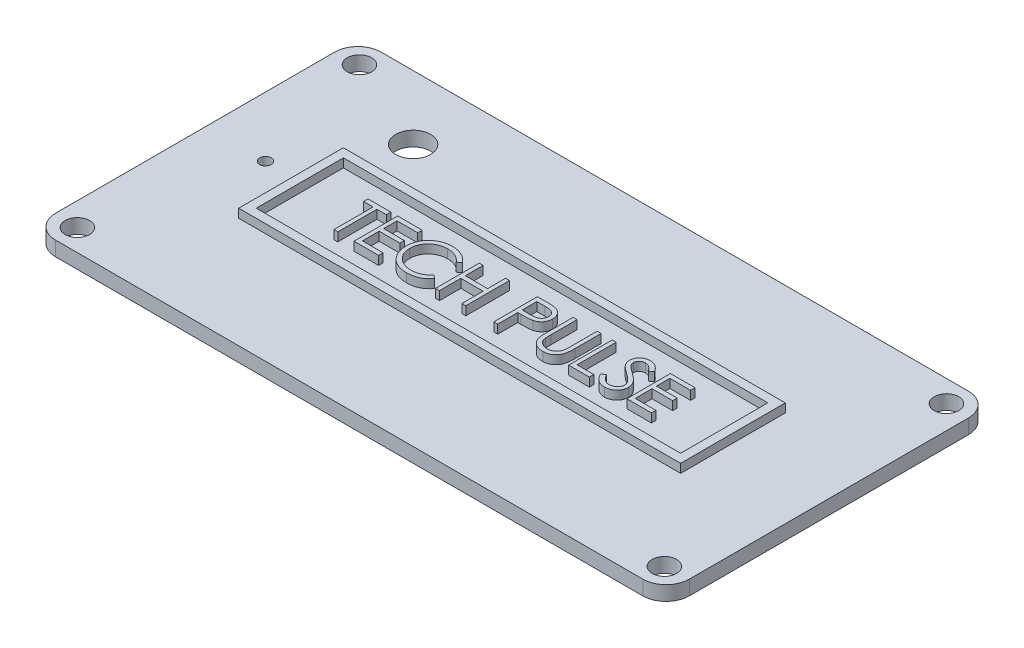
from build123d import *

# Parameters (mm, degrees)
SKETCH1_W           = 109
SKETCH1_H           = 56
TOP_PLATE_DEPTH     = 2.5
FILLET2_R           = 4
SKETCH7_R           = 3
CUT_EXTRUDE3_DEPTH  = 5
SKETCH11_R          = 2.1
CUT_EXTRUDE5_DEPTH  = 4
SKETCH12_W          = 76
SKETCH12_H          = 18
BOSS_EXTRUDE1_DEPTH = 1.5
SKETCH13_W          = 73
SKETCH13_H          = 15
CUT_EXTRUDE6_DEPTH  = 1.5
BOSS_EXTRUDE2_DEPTH = 1.5
SKETCH15_R          = 1
CUT_EXTRUDE7_DEPTH  = 3


with BuildPart() as part:
    # Sketch1 → Top_Plate (new body)
    with BuildSketch(Plane(origin=(0, 0, 0), x_dir=(1, 0, 0), z_dir=(0, 1, 0))):
        Rectangle(SKETCH1_W, SKETCH1_H)
    extrude(amount=TOP_PLATE_DEPTH)

    # Fillet2
    fillet2_edges = [part.edges().sort_by_distance(p)[0] for p in [
        (-54.5, 1.25, -28),
        (54.5, 1.25, -28),
        (54.5, 1.25, 28),
        (-54.5, 1.25, 28),
    ]]
    fillet(fillet2_edges, radius=FILLET2_R)

    # Sketch7 → Cut-Extrude3 (cut)
    with BuildSketch(Plane(origin=(0, 2.5, 0), x_dir=(1, 0, 0), z_dir=(0, 1, 0))):
        with Locations(Location((-34, 17, 0), (0, 0, 270))):
            Circle(SKETCH7_R)
    extrude(amount=-CUT_EXTRUDE3_DEPTH, mode=Mode.SUBTRACT)

    # Sketch11 → Cut-Extrude5 (cut)
    with BuildSketch(Plane(origin=(0, 2.5, 0), x_dir=(1, 0, 0), z_dir=(0, 1, 0))):
        with Locations(Location((-50.477110926, 24.241441247, 0), (0, 0, 270))):
            Circle(SKETCH11_R)
        with Locations(Location((-50.492546185, -24.258556297, 0), (0, 0, 270))):
            Circle(SKETCH11_R)
        with Locations(Location((50.461675666, -24.258556297, 0), (0, 0, 270))):
            Circle(SKETCH11_R)
        with Locations(Location((50.477110926, 24.241441247, 0), (0, 0, 270))):
            Circle(SKETCH11_R)
    extrude(amount=-CUT_EXTRUDE5_DEPTH, mode=Mode.SUBTRACT)

    # Sketch12 → Boss-Extrude1 (add)
    with BuildSketch(Plane(origin=(0, 2.5, 0), x_dir=(1, 0, 0), z_dir=(0, 1, 0))):
        Rectangle(SKETCH12_W, SKETCH12_H)
    extrude(amount=BOSS_EXTRUDE1_DEPTH)

    # Sketch13 → Cut-Extrude6 (cut)
    with BuildSketch(Plane(origin=(0, 4, 0), x_dir=(1, 0, 0), z_dir=(0, 1, 0))):
        Rectangle(SKETCH13_W, SKETCH13_H)
    extrude(amount=-CUT_EXTRUDE6_DEPTH, mode=Mode.SUBTRACT)

    # Sketch14 → Boss-Extrude2 (add)
    # profile 1 of 9: a face of its own
    with BuildSketch(Plane(origin=(0, 2.5, 0), x_dir=(1, 0, 0), z_dir=(0, 1, 0))):
        Polygon((-28.269230769, 2.730769231), (-28.269230769, 3.5), (-24.326923077, 3.5), (-24.326923077, 2.730769231), (-25.961538462, 2.730769231), (-25.961538462, -4), (-26.634615385, -4), (-26.634615385, 2.730769231), align=None)
    # profile 2 of 9: a face of its own
    with BuildSketch(Plane(origin=(0, 2.5, 0), x_dir=(1, 0, 0), z_dir=(0, 1, 0))):
        Polygon((-23.173076923, 3.5), (-18.942307692, 3.5), (-18.942307692, 2.730769231), (-22.5, 2.730769231), (-22.5, 0.423076923), (-18.942307692, 0.423076923), (-18.942307692, -0.346153846), (-22.5, -0.346153846), (-22.5, -3.230769231), (-18.942307692, -3.230769231), (-18.942307692, -4), (-23.173076923, -4), align=None)
    # profile 3 of 9: a face of its own
    with BuildSketch(Plane(origin=(0, 2.5, 0), x_dir=(1, 0, 0), z_dir=(0, 1, 0))):
        with BuildLine():
            Line((-10.673076923, 2.123798077), (-11.262019231, 1.673076923))
            add(Edge.make_bspline(
                [(-11.262019231, 1.673076923), (-11.304031849, 1.723146858), (-11.387490663, 1.822611678), (-11.521760383, 1.96228213), (-11.661692475, 2.093136262), (-11.807233449, 2.215797433), (-11.961002991, 2.325976216), (-12.119276131, 2.429414294), (-12.284700513, 2.522130875), (-12.51345423, 2.63455156), (-12.81269962, 2.751864749), (-13.189402846, 2.850228816), (-13.582640914, 2.912845621), (-13.850921485, 2.919627424), (-13.987379808, 2.923076923)],
                knots=[0, 0, 0, 0, 0.757959112, 1.505699292, 2.245454638, 2.979532153, 3.711538275, 4.438200793, 5.171680507, 5.909471876, 7.393775596, 8.890124382, 10.418191784, 12, 12, 12, 12], degree=3))
            add(Edge.make_bspline(
                [(-13.987379808, 2.923076923), (-14.062558306, 2.922211289), (-14.212217576, 2.920488055), (-14.434321448, 2.897754215), (-14.652277986, 2.865801622), (-14.865945414, 2.818390216), (-15.075051753, 2.758448889), (-15.280964043, 2.686823002), (-15.480701043, 2.598205488), (-15.677025839, 2.500259217), (-15.865124148, 2.389628978), (-16.043099251, 2.26895751), (-16.210302039, 2.13959516), (-16.36686478, 2.001057075), (-16.512947526, 1.85396716), (-16.647491763, 1.696757856), (-16.770031928, 1.52993177), (-16.882996982, 1.355688754), (-16.984167125, 1.174536343), (-17.068874009, 0.98580405), (-17.143884985, 0.792723829), (-17.203240505, 0.593114198), (-17.250221613, 0.3883797), (-17.282638034, 0.177970869), (-17.30511333, -0.03767273), (-17.306827994, -0.183835543), (-17.307692308, -0.257512019)],
                knots=[0, 0, 0, 0, 1.054917814, 2.100044995, 3.131103042, 4.146048494, 5.169673617, 6.183595914, 7.203665975, 8.234915748, 9.262203917, 10.264457458, 11.251630812, 12.227803204, 13.197192746, 14.159520551, 15.12972552, 16.100847026, 17.073214652, 18.039054194, 19.002613845, 19.979014051, 20.95965708, 21.949030935, 22.966165397, 24, 24, 24, 24], degree=3))
            add(Edge.make_bspline(
                [(-17.307692308, -0.257512019), (-17.30498841, -0.368364848), (-17.299679665, -0.586009672), (-17.252433235, -0.904803838), (-17.180636611, -1.210205282), (-17.073031803, -1.500304944), (-16.940348123, -1.778679997), (-16.77268967, -2.040620397), (-16.578511375, -2.290084464), (-16.355066191, -2.521176495), (-16.109910871, -2.732277334), (-15.846879632, -2.918171438), (-15.566627587, -3.0731319), (-15.272249093, -3.202080357), (-14.961478849, -3.301201916), (-14.634875701, -3.370982181), (-14.293149997, -3.416501139), (-14.05964414, -3.420859042), (-13.940805288, -3.423076923)],
                knots=[0, 0, 0, 0, 1.029171465, 2.020641659, 2.987623507, 3.938342917, 4.889210282, 5.84687017, 6.821220943, 7.821438502, 8.827599549, 9.822697543, 10.807740252, 11.797342354, 12.80366471, 13.83203677, 14.896651826, 16, 16, 16, 16], degree=3))
            add(Edge.make_bspline(
                [(-13.940805288, -3.423076923), (-13.809870955, -3.419458109), (-13.552160864, -3.412335418), (-13.174229379, -3.35199417), (-12.812438453, -3.254155775), (-12.466768625, -3.117231655), (-12.138194383, -2.93923461), (-11.826201539, -2.723453444), (-11.530526745, -2.467835588), (-11.352731141, -2.272657456), (-11.262019231, -2.173076923)],
                knots=[0, 0, 0, 0, 1.028121516, 2.023589091, 2.998037872, 3.967518031, 4.937445131, 5.927275754, 6.942489185, 8, 8, 8, 8], degree=3))
            Line((-11.262019231, -2.173076923), (-10.673076923, -2.619290865))
            add(Edge.make_bspline(
                [(-10.673076923, -2.619290865), (-10.720472873, -2.680444691), (-10.815037748, -2.802459419), (-10.968162071, -2.974470225), (-11.129470565, -3.136264587), (-11.300161372, -3.286538061), (-11.478270925, -3.42829763), (-11.666997309, -3.55751584), (-11.863859522, -3.675996306), (-12.068190548, -3.784482573), (-12.27977329, -3.880733817), (-12.498354222, -3.963134748), (-12.722991169, -4.034116654), (-12.953694401, -4.092513661), (-13.190942452, -4.138094555), (-13.433879182, -4.168565287), (-13.683028915, -4.189440818), (-13.851117674, -4.191343495), (-13.936298077, -4.192307692)],
                knots=[0, 0, 0, 0, 0.986787822, 1.968848986, 2.935600012, 3.899624008, 4.868462664, 5.837806735, 6.815139263, 7.798259679, 8.787526145, 9.778297419, 10.776456485, 11.791383307, 12.812564526, 13.85620153, 14.913611965, 16, 16, 16, 16], degree=3))
            add(Edge.make_bspline(
                [(-13.936298077, -4.192307692), (-14.016963078, -4.19174628), (-14.176468128, -4.190636156), (-14.411965453, -4.17265294), (-14.64122884, -4.148117789), (-14.863603039, -4.111174651), (-15.080301557, -4.067579637), (-15.289359952, -4.00914123), (-15.492835403, -3.94367873), (-15.689910418, -3.866739473), (-15.880752632, -3.779919082), (-16.064746514, -3.681794313), (-16.24180744, -3.573190317), (-16.413676199, -3.456501009), (-16.577813879, -3.327978219), (-16.735642861, -3.189406859), (-16.888048168, -3.041253979), (-16.982339636, -2.934422151), (-17.029747596, -2.880709135)],
                knots=[0, 0, 0, 0, 1.114604814, 2.203992996, 3.262667896, 4.300477797, 5.318619304, 6.316056647, 7.298880507, 8.271930387, 9.238335007, 10.195173496, 11.151986948, 12.108099108, 13.064862484, 14.031167946, 15.010108607, 16, 16, 16, 16], degree=3))
            add(Edge.make_bspline(
                [(-17.029747596, -2.880709135), (-17.105681118, -2.787406587), (-17.256631425, -2.601927922), (-17.44975789, -2.301315105), (-17.61507408, -1.987454657), (-17.748736767, -1.658697667), (-17.853228338, -1.315781837), (-17.925616614, -0.958534306), (-17.972655766, -0.587288716), (-17.978034956, -0.334781312), (-17.980769231, -0.206430288)],
                knots=[0, 0, 0, 0, 0.994628077, 1.977248131, 2.950237994, 3.925870899, 4.908910175, 5.911660606, 6.938484602, 8, 8, 8, 8], degree=3))
            add(Edge.make_bspline(
                [(-17.980769231, -0.206430288), (-17.977436673, -0.071525745), (-17.970880074, 0.193890522), (-17.915174798, 0.583406136), (-17.825563092, 0.956587705), (-17.698284045, 1.312738586), (-17.536915435, 1.653732044), (-17.337572691, 1.976963197), (-17.102571672, 2.284499196), (-16.833755456, 2.571673663), (-16.538968308, 2.83425799), (-16.223285136, 3.065271284), (-15.887323821, 3.257523104), (-15.534785567, 3.418229167), (-15.163030535, 3.541753016), (-14.772851887, 3.62822413), (-14.364982784, 3.682046522), (-14.086706158, 3.688850539), (-13.9453125, 3.692307692)],
                knots=[0, 0, 0, 0, 1.032925535, 2.032216505, 3.007276963, 3.968222605, 4.92396291, 5.891752235, 6.871517503, 7.883894988, 8.900124299, 9.891468569, 10.874487609, 11.85992873, 12.854644235, 13.869047385, 14.917252991, 16, 16, 16, 16], degree=3))
            add(Edge.make_bspline(
                [(-13.9453125, 3.692307692), (-13.859138632, 3.691274539), (-13.688566137, 3.689229516), (-13.436239025, 3.669287783), (-13.190576896, 3.636044341), (-12.951410506, 3.59079562), (-12.717576328, 3.534637074), (-12.490861526, 3.461479292), (-12.269935769, 3.377829582), (-12.056192394, 3.281490012), (-11.85065693, 3.173346995), (-11.65339339, 3.05459923), (-11.465968693, 2.925393933), (-11.287064017, 2.786829985), (-11.119672137, 2.63597593), (-10.959040397, 2.476981081), (-10.810623801, 2.305265744), (-10.719009811, 2.184398028), (-10.673076923, 2.123798077)],
                knots=[0, 0, 0, 0, 1.096760587, 2.17092713, 3.219439832, 4.250915756, 5.268269357, 6.278326846, 7.281116186, 8.274029601, 9.260640565, 10.235837813, 11.203064059, 12.156899882, 13.114053108, 14.069676657, 15.032185724, 16, 16, 16, 16], degree=3))
        make_face()
    # profile 4 of 9: a face of its own
    with BuildSketch(Plane(origin=(0, 2.5, 0), x_dir=(1, 0, 0), z_dir=(0, 1, 0))):
        Polygon((-9.134615385, 3.5), (-8.461538462, 3.5), (-8.461538462, 0.423076923), (-4.615384615, 0.423076923), (-4.615384615, 3.5), (-3.942307692, 3.5), (-3.942307692, -4), (-4.615384615, -4), (-4.615384615, -0.346153846), (-8.461538462, -0.346153846), (-8.461538462, -4), (-9.134615385, -4), align=None)
    # profile 5 of 9: a face of its own
    with BuildSketch(Plane(origin=(0, 2.5, 0), x_dir=(1, 0, 0), z_dir=(0, 1, 0))):
        with BuildLine():
            Line((0.865384615, 3.5), (2.336237981, 3.5))
            add(Edge.make_bspline(
                [(2.336237981, 3.5), (2.437404208, 3.499888794), (2.631243193, 3.499675718), (2.909204026, 3.493215548), (3.161653451, 3.484586922), (3.388047125, 3.472625722), (3.589081621, 3.458490172), (3.763847263, 3.438664373), (3.91371774, 3.41796374), (4.003517275, 3.396917869), (4.044471154, 3.387319712)],
                knots=[0, 0, 0, 0, 1.415646017, 2.712440637, 3.8905458, 4.950247383, 5.884950622, 6.709939814, 7.411656543, 8, 8, 8, 8], degree=3))
            add(Edge.make_bspline(
                [(4.044471154, 3.387319712), (4.096314441, 3.373129819), (4.198779392, 3.345084401), (4.346424484, 3.288912137), (4.48689701, 3.222307497), (4.620678921, 3.146399054), (4.746126242, 3.057929988), (4.865110615, 2.960486522), (4.976582002, 2.851818875), (5.079913556, 2.733145861), (5.174809551, 2.606459697), (5.256516014, 2.469869204), (5.3249315, 2.325673554), (5.383609939, 2.173973044), (5.425842341, 2.01349378), (5.457657127, 1.845350825), (5.477850614, 1.669562203), (5.479784675, 1.549433915), (5.480769231, 1.48828125)],
                knots=[0, 0, 0, 0, 0.999701418, 1.975846123, 2.934577507, 3.890451536, 4.834027766, 5.787354733, 6.749476667, 7.726910423, 8.712836071, 9.690891519, 10.682875813, 11.679750201, 12.712814741, 13.765529915, 14.8625177, 16, 16, 16, 16], degree=3))
            add(Edge.make_bspline(
                [(5.480769231, 1.48828125), (5.479866178, 1.426614585), (5.478099294, 1.305959591), (5.456892968, 1.129446474), (5.428328272, 0.960764209), (5.384406017, 0.800286815), (5.326879574, 0.648967307), (5.259396604, 0.504493239), (5.178003324, 0.369322513), (5.084478689, 0.242964404), (4.980439559, 0.125300306), (4.86632612, 0.017182889), (4.742599064, -0.080754979), (4.609651604, -0.168732858), (4.466187642, -0.2447106), (4.314383028, -0.312761967), (4.152918278, -0.36991424), (4.04118432, -0.399978658), (3.984375, -0.415264423)],
                knots=[0, 0, 0, 0, 1.121902311, 2.195077645, 3.232258892, 4.234102512, 5.217864754, 6.176164875, 7.132989551, 8.084763148, 9.034132444, 9.988522005, 10.94243251, 11.903244335, 12.886203696, 13.894208494, 14.929344452, 16, 16, 16, 16], degree=3))
            add(Edge.make_bspline(
                [(3.984375, -0.415264423), (3.937387856, -0.425256525), (3.834412797, -0.447154799), (3.66482125, -0.471601492), (3.467366851, -0.492467779), (3.242319108, -0.508113074), (2.989880027, -0.521506721), (2.709913047, -0.532152636), (2.401868595, -0.538002323), (2.187001644, -0.538304022), (2.074819712, -0.538461538)],
                knots=[0, 0, 0, 0, 0.601384939, 1.31797006, 2.144135048, 3.087295005, 4.142315834, 5.309527816, 6.595305764, 8, 8, 8, 8], degree=3))
            Line((2.074819712, -0.538461538), (1.538461538, -0.538461538))
            Line((1.538461538, -0.538461538), (1.538461538, -4))
            Line((1.538461538, -4), (0.865384615, -4))
            Line((0.865384615, -4), (0.865384615, 3.5))
        make_face()
        with BuildLine():
            Line((1.538461538, 2.730769231), (1.538461538, 0.230769231))
            Line((1.538461538, 0.230769231), (2.8515625, 0.214242788))
            add(Edge.make_bspline(
                [(2.8515625, 0.214242788), (2.915676627, 0.214209652), (3.039447627, 0.214145683), (3.218239534, 0.222685448), (3.384116578, 0.232543732), (3.536569239, 0.246977854), (3.675666242, 0.267380549), (3.801639518, 0.28797713), (3.913512267, 0.317774335), (4.044439128, 0.357895198), (4.190332015, 0.426322231), (4.349048191, 0.525643424), (4.48355659, 0.652244942), (4.59995294, 0.794590295), (4.692322679, 0.952945572), (4.759942662, 1.122379008), (4.799673714, 1.301152971), (4.805001272, 1.423484697), (4.807692308, 1.485276442)],
                knots=[0, 0, 0, 0, 1.160613943, 2.240541288, 3.23993089, 4.169200891, 5.011653406, 5.7853311, 6.478053781, 7.106038997, 8.262395093, 9.384106736, 10.481365981, 11.59014053, 12.70357646, 13.786202915, 14.881775077, 16, 16, 16, 16], degree=3))
            add(Edge.make_bspline(
                [(4.807692308, 1.485276442), (4.804986637, 1.545573257), (4.799608097, 1.665435861), (4.759631248, 1.841104634), (4.692454147, 2.008752572), (4.599332873, 2.165123469), (4.486316166, 2.306956621), (4.35496043, 2.43016475), (4.20557487, 2.529211256), (4.066614375, 2.593139717), (3.943183262, 2.63217245), (3.83597192, 2.659482822), (3.714920474, 2.681287693), (3.579989518, 2.69894377), (3.432224874, 2.71405833), (3.270357057, 2.724313995), (3.09499925, 2.730317116), (2.973262312, 2.730614877), (2.91015625, 2.730769231)],
                knots=[0, 0, 0, 0, 1.120700087, 2.227813068, 3.331159281, 4.466773991, 5.599788987, 6.693661531, 7.80175334, 8.91857717, 9.525282508, 10.207424825, 10.974604443, 11.810962634, 12.737642355, 13.736264703, 14.826523623, 16, 16, 16, 16], degree=3))
            Line((2.91015625, 2.730769231), (1.538461538, 2.730769231))
        make_face(mode=Mode.SUBTRACT)
    # profile 6 of 9: a face of its own
    with BuildSketch(Plane(origin=(0, 2.5, 0), x_dir=(1, 0, 0), z_dir=(0, 1, 0))):
        with BuildLine():
            Line((7.019230769, 3.5), (7.692307692, 3.5))
            Line((7.692307692, 3.5), (7.692307692, -0.993689904))
            add(Edge.make_bspline(
                [(7.692307692, -0.993689904), (7.692207527, -1.05729148), (7.692017445, -1.177986432), (7.693287118, -1.349775648), (7.696842907, -1.502502346), (7.699084678, -1.636755234), (7.704071821, -1.751918264), (7.708139064, -1.848615358), (7.713368829, -1.926388649), (7.71965408, -1.971776348), (7.722355769, -1.991286058)],
                knots=[0, 0, 0, 0, 1.528628734, 2.90083645, 4.128790002, 5.200304208, 6.127813768, 6.898992206, 7.526736466, 8, 8, 8, 8], degree=3))
            add(Edge.make_bspline(
                [(7.722355769, -1.991286058), (7.733450324, -2.061671979), (7.755014295, -2.198477827), (7.809970818, -2.393281288), (7.886722606, -2.568848699), (7.977671983, -2.730658609), (8.097527579, -2.874207237), (8.241106583, -3.006446493), (8.415058945, -3.12210036), (8.608474528, -3.2278521), (8.816942894, -3.312848705), (9.029967036, -3.3771202), (9.244344849, -3.416289271), (9.387865203, -3.420824712), (9.459134615, -3.423076923)],
                knots=[0, 0, 0, 0, 1.035780045, 2.013197591, 2.933192213, 3.817615948, 4.702609284, 5.640816605, 6.646850145, 7.73207398, 8.84249596, 9.914020372, 10.964143139, 12, 12, 12, 12], degree=3))
            add(Edge.make_bspline(
                [(9.459134615, -3.423076923), (9.520321202, -3.420775815), (9.642340977, -3.41618689), (9.823640472, -3.387769538), (10.000212133, -3.33655404), (10.172927876, -3.270468844), (10.334822842, -3.183152577), (10.485987361, -3.082286493), (10.620910077, -2.963977472), (10.744034358, -2.833048163), (10.851252078, -2.68532002), (10.944190239, -2.524009724), (11.020317231, -2.346689695), (11.057910498, -2.222073076), (11.077223558, -2.158052885)],
                knots=[0, 0, 0, 0, 0.994687771, 1.983630487, 2.973142513, 3.978332533, 4.983357753, 5.956394766, 6.925816176, 7.893390482, 8.871859704, 9.88551698, 10.913711441, 12, 12, 12, 12], degree=3))
            add(Edge.make_bspline(
                [(11.077223558, -2.158052885), (11.083652398, -2.131591654), (11.097978444, -2.072625368), (11.111364969, -1.972936888), (11.125307523, -1.855316823), (11.134981602, -1.718920081), (11.144412788, -1.564203711), (11.150055087, -1.390361731), (11.152663015, -1.198025386), (11.153440187, -1.063802897), (11.153846154, -0.993689904)],
                knots=[0, 0, 0, 0, 0.558680831, 1.244966039, 2.062412453, 2.990489873, 4.051219941, 5.244515665, 6.560634259, 8, 8, 8, 8], degree=3))
            Line((11.153846154, -0.993689904), (11.153846154, 3.5))
            Line((11.153846154, 3.5), (11.826923077, 3.5))
            Line((11.826923077, 3.5), (11.826923077, -1.029747596))
            add(Edge.make_bspline(
                [(11.826923077, -1.029747596), (11.826378533, -1.11138698), (11.825315823, -1.2707112), (11.816100302, -1.504178398), (11.801406731, -1.725649072), (11.780646542, -1.935152993), (11.753138679, -2.131940477), (11.72254892, -2.317736409), (11.683592778, -2.491207108), (11.638092633, -2.653705146), (11.586077887, -2.808388389), (11.518703998, -2.955192563), (11.442794355, -3.098580562), (11.352762956, -3.236383653), (11.251595707, -3.369211981), (11.137056391, -3.496259999), (11.012933189, -3.619557955), (10.877162705, -3.735943097), (10.731983008, -3.842675976), (10.577825955, -3.936528342), (10.415875735, -4.015864666), (10.246553321, -4.081170218), (10.069786458, -4.13027293), (9.885570687, -4.16686255), (9.693486702, -4.187653187), (9.562848153, -4.190743038), (9.496694712, -4.192307692)],
                knots=[0, 0, 0, 0, 1.316592851, 2.569410997, 3.76748051, 4.895814652, 5.963796859, 6.97159953, 7.931736103, 8.829262218, 9.692595152, 10.560224239, 11.431080259, 12.30701507, 13.211635791, 14.121146779, 15.063487852, 16.031507147, 17.00238618, 17.966455255, 18.938106653, 19.907068911, 20.888905087, 21.893141452, 22.933117798, 24, 24, 24, 24], degree=3))
            add(Edge.make_bspline(
                [(9.496694712, -4.192307692), (9.424546635, -4.190626052), (9.282992365, -4.187326681), (9.074410793, -4.168420788), (8.874451801, -4.132809943), (8.681003493, -4.087467206), (8.49669957, -4.024930627), (8.319070761, -3.951863216), (8.151159301, -3.86212623), (7.990241169, -3.762283245), (7.840616691, -3.649944734), (7.703265113, -3.527501505), (7.577959676, -3.396914982), (7.46681247, -3.256771341), (7.367982003, -3.10816054), (7.282845831, -2.950662169), (7.209746022, -2.784337206), (7.172017664, -2.668723205), (7.152944712, -2.610276442)],
                knots=[0, 0, 0, 0, 1.13879206, 2.234305948, 3.301075583, 4.341971843, 5.366689343, 6.369221514, 7.369726634, 8.367512178, 9.355451585, 10.318319045, 11.268648973, 12.207971039, 13.137398894, 14.081662264, 15.030215811, 16, 16, 16, 16], degree=3))
            add(Edge.make_bspline(
                [(7.152944712, -2.610276442), (7.141850801, -2.570349497), (7.117787863, -2.483747064), (7.092019368, -2.340418874), (7.07035705, -2.175386907), (7.049987996, -1.988639868), (7.037968801, -1.780033011), (7.027431432, -1.549656763), (7.019156535, -1.297232559), (7.019205333, -1.121401454), (7.019230769, -1.029747596)],
                knots=[0, 0, 0, 0, 0.625038921, 1.35572334, 2.194682327, 3.136881307, 4.189498639, 5.346923369, 6.617055217, 8, 8, 8, 8], degree=3))
            Line((7.019230769, -1.029747596), (7.019230769, 3.5))
        make_face()
    # profile 7 of 9: a face of its own
    with BuildSketch(Plane(origin=(0, 2.5, 0), x_dir=(1, 0, 0), z_dir=(0, 1, 0))):
        Polygon((13.75, 3.5), (14.423076923, 3.5), (14.423076923, -3.230769231), (17.307692308, -3.230769231), (17.307692308, -4), (13.75, -4), align=None)
    # profile 8 of 9: a face of its own
    with BuildSketch(Plane(origin=(0, 2.5, 0), x_dir=(1, 0, 0), z_dir=(0, 1, 0))):
        with BuildLine():
            Line((17.788461538, -2.553185096), (18.422475962, -2.173076923))
            add(Edge.make_bspline(
                [(18.422475962, -2.173076923), (18.481443613, -2.271786319), (18.594423357, -2.460909713), (18.782890555, -2.716462657), (18.978175365, -2.933667279), (19.181723937, -3.111260009), (19.392293826, -3.251079052), (19.611259655, -3.350083835), (19.837883535, -3.411832353), (19.992113153, -3.419332539), (20.069110577, -3.423076923)],
                knots=[0, 0, 0, 0, 1.272034388, 2.437168799, 3.508375237, 4.49857839, 5.41946034, 6.295179144, 7.148887113, 8, 8, 8, 8], degree=3))
            add(Edge.make_bspline(
                [(20.069110577, -3.423076923), (20.134868135, -3.421245482), (20.265232649, -3.417614646), (20.457151741, -3.382727213), (20.643541317, -3.329129794), (20.820559827, -3.252370655), (20.985764715, -3.159502471), (21.130636205, -3.047332091), (21.255877876, -2.921747364), (21.358325979, -2.781641676), (21.436926054, -2.630962071), (21.497337629, -2.476299319), (21.530862787, -2.315223815), (21.535912973, -2.206772823), (21.538461538, -2.152043269)],
                knots=[0, 0, 0, 0, 1.095163259, 2.171163733, 3.241058638, 4.321873601, 5.38011039, 6.391990106, 7.366004449, 8.327778327, 9.272591725, 10.192022065, 11.087607919, 12, 12, 12, 12], degree=3))
            add(Edge.make_bspline(
                [(21.538461538, -2.152043269), (21.535302301, -2.089598591), (21.528880034, -1.962657686), (21.474598291, -1.775372715), (21.389207047, -1.590031494), (21.310429954, -1.475385925), (21.26953125, -1.415865385)],
                knots=[0, 0, 0, 0, 0.938893495, 1.908633276, 2.914225137, 4, 4, 4, 4], degree=3))
            add(Edge.make_bspline(
                [(21.26953125, -1.415865385), (21.235951362, -1.372907905), (21.165454589, -1.282724051), (21.044259919, -1.148484261), (20.902046817, -1.01001622), (20.743682057, -0.862032527), (20.563396866, -0.71141582), (20.366837907, -0.550983796), (20.14898678, -0.386837559), (19.996202145, -0.27675349), (19.917367788, -0.219951923)],
                knots=[0, 0, 0, 0, 0.722233717, 1.516239348, 2.393582979, 3.351407094, 4.387010283, 5.505090956, 6.712668013, 8, 8, 8, 8], degree=3))
            add(Edge.make_bspline(
                [(19.917367788, -0.219951923), (19.838459225, -0.163747807), (19.687592061, -0.056289816), (19.476609385, 0.103190792), (19.287942678, 0.248999084), (19.1224305, 0.382507682), (18.98014565, 0.503734692), (18.859966912, 0.61151599), (18.764955718, 0.708766477), (18.712122331, 0.771855067), (18.688401442, 0.800180288)],
                knots=[0, 0, 0, 0, 1.452282411, 2.77665338, 3.964542531, 5.026858415, 5.96415736, 6.766646006, 7.446254459, 8, 8, 8, 8], degree=3))
            add(Edge.make_bspline(
                [(18.688401442, 0.800180288), (18.655245988, 0.844325367), (18.590041338, 0.93114259), (18.503971326, 1.066838714), (18.430815978, 1.205745711), (18.373468123, 1.348236849), (18.325176225, 1.492311697), (18.292694945, 1.63985008), (18.272356238, 1.790189977), (18.270273409, 1.891361764), (18.269230769, 1.942007212)],
                knots=[0, 0, 0, 0, 1.068054152, 2.10047183, 3.106115577, 4.101338837, 5.06977816, 6.043150881, 7.020423561, 8, 8, 8, 8], degree=3))
            add(Edge.make_bspline(
                [(18.269230769, 1.942007212), (18.272027646, 2.021356728), (18.277561617, 2.178359722), (18.324362726, 2.407711502), (18.398233212, 2.626682396), (18.501722257, 2.833104539), (18.635130871, 3.02160307), (18.789515102, 3.194346256), (18.973396858, 3.339564647), (19.175152479, 3.466447629), (19.395987562, 3.565760326), (19.627396641, 3.640676712), (19.86974751, 3.683125121), (20.033897084, 3.68921676), (20.1171875, 3.692307692)],
                knots=[0, 0, 0, 0, 1.005424448, 1.989358655, 2.955360095, 3.929531133, 4.905563448, 5.876582895, 6.856512386, 7.866279853, 8.892233794, 9.918561126, 10.94386622, 12, 12, 12, 12], degree=3))
            add(Edge.make_bspline(
                [(20.1171875, 3.692307692), (20.205567715, 3.689259367), (20.381327754, 3.683197222), (20.639861788, 3.630488227), (20.888777609, 3.543272501), (21.089013176, 3.444296806), (21.245726236, 3.345443772), (21.365239235, 3.255401291), (21.486348058, 3.151740344), (21.610029604, 3.034184817), (21.73418816, 2.901656065), (21.860666986, 2.755061731), (21.989761848, 2.595297683), (22.07281012, 2.481245181), (22.115384615, 2.422776442)],
                knots=[0, 0, 0, 0, 1.286793592, 2.559021753, 3.825965368, 5.121522368, 5.803751409, 6.523245864, 7.299691795, 8.125521123, 9.008227632, 9.944561021, 10.946284179, 12, 12, 12, 12], degree=3))
            Line((22.115384615, 2.422776442), (21.506911058, 1.961538462))
            add(Edge.make_bspline(
                [(21.506911058, 1.961538462), (21.470169774, 2.00887137), (21.399414652, 2.100023484), (21.291994323, 2.227676303), (21.19074722, 2.344283045), (21.090996363, 2.445565462), (20.99801001, 2.537070033), (20.907759205, 2.615412369), (20.821542738, 2.681360074), (20.712863644, 2.751739131), (20.576325676, 2.821503067), (20.404930241, 2.880536806), (20.225816795, 2.916011939), (20.103824727, 2.920702412), (20.042067308, 2.923076923)],
                knots=[0, 0, 0, 0, 1.181633172, 2.275549214, 3.290209073, 4.226197932, 5.078386478, 5.862611352, 6.581680152, 7.217281963, 8.414376989, 9.595101626, 10.782541182, 12, 12, 12, 12], degree=3))
            add(Edge.make_bspline(
                [(20.042067308, 2.923076923), (19.964589045, 2.920480423), (19.815179515, 2.915473318), (19.603057581, 2.860787635), (19.412142027, 2.774683649), (19.248100816, 2.654008696), (19.11152158, 2.51103514), (19.012724168, 2.346509022), (18.95325953, 2.164832445), (18.946003216, 2.038100324), (18.942307692, 1.973557692)],
                knots=[0, 0, 0, 0, 1.14458467, 2.207223713, 3.21896685, 4.227309161, 5.202851033, 6.127160689, 7.046193047, 8, 8, 8, 8], degree=3))
            add(Edge.make_bspline(
                [(18.942307692, 1.973557692), (18.943150107, 1.933375953), (18.944836312, 1.852946768), (18.968353736, 1.734122292), (18.998566584, 1.615597994), (19.046443652, 1.497906745), (19.112540731, 1.378990261), (19.199337537, 1.256800823), (19.308651777, 1.130261448), (19.392388232, 1.047959933), (19.436598558, 1.004507212)],
                knots=[0, 0, 0, 0, 0.858281714, 1.717966888, 2.583508476, 3.4729293, 4.427298488, 5.488583878, 6.674047936, 8, 8, 8, 8], degree=3))
            add(Edge.make_bspline(
                [(19.436598558, 1.004507212), (19.453015784, 0.989856442), (19.492019357, 0.955049567), (19.563324912, 0.898066108), (19.657488051, 0.827774454), (19.772049911, 0.740801632), (19.909122829, 0.639912785), (20.068721877, 0.526397902), (20.249068019, 0.396571918), (20.377043553, 0.30580576), (20.444711538, 0.2578125)],
                knots=[0, 0, 0, 0, 0.420754252, 0.999615792, 1.744751191, 2.668019286, 3.750313428, 4.999500688, 6.413464383, 8, 8, 8, 8], degree=3))
            add(Edge.make_bspline(
                [(20.444711538, 0.2578125), (20.526109924, 0.198581015), (20.683726616, 0.083887454), (20.907992859, -0.08843186), (21.111336734, -0.256962793), (21.29447217, -0.420629094), (21.459208402, -0.578189293), (21.603717804, -0.731538965), (21.729472833, -0.879579478), (21.864856872, -1.069377854), (22.003195057, -1.302480178), (22.121998287, -1.588076403), (22.196909032, -1.874782804), (22.206705136, -2.067483168), (22.211538462, -2.162560096)],
                knots=[0, 0, 0, 0, 1.163667725, 2.253281268, 3.268753668, 4.215851969, 5.092017293, 5.902905408, 6.650798638, 7.335211899, 8.59617414, 9.77448103, 10.901945474, 12, 12, 12, 12], degree=3))
            add(Edge.make_bspline(
                [(22.211538462, -2.162560096), (22.210130308, -2.22979945), (22.207341348, -2.362972415), (22.175282247, -2.558519008), (22.128311536, -2.7484423), (22.057517463, -2.930394684), (21.971110695, -3.10770489), (21.861468735, -3.275721819), (21.73438084, -3.438164102), (21.5885942, -3.590700155), (21.429067267, -3.730727718), (21.26045935, -3.855289992), (21.082494479, -3.959150685), (20.896138086, -4.04390249), (20.701347365, -4.110188599), (20.498187828, -4.158216175), (20.28632459, -4.187692699), (20.142323558, -4.190752187), (20.069110577, -4.192307692)],
                knots=[0, 0, 0, 0, 0.983748083, 1.948392443, 2.894712957, 3.844097841, 4.80183111, 5.778335162, 6.776009319, 7.81870978, 8.863265674, 9.881300176, 10.883814829, 11.87499822, 12.874611388, 13.892143829, 14.928324115, 16, 16, 16, 16], degree=3))
            add(Edge.make_bspline(
                [(20.069110577, -4.192307692), (20.012463413, -4.191212303), (19.899882499, -4.18903532), (19.733362181, -4.169789719), (19.570205918, -4.142560212), (19.412461028, -4.099330062), (19.258095146, -4.046879397), (19.107779643, -3.982297255), (18.961441671, -3.904903252), (18.818261136, -3.816413914), (18.678602191, -3.713433032), (18.543774759, -3.593489826), (18.409355076, -3.459892315), (18.279310655, -3.309012536), (18.15101106, -3.143288073), (18.026985897, -2.961168395), (17.904667931, -2.763645494), (17.8279205, -2.624648881), (17.788461538, -2.553185096)],
                knots=[0, 0, 0, 0, 0.915332311, 1.819136955, 2.706846663, 3.586547465, 4.459518054, 5.340707479, 6.227863349, 7.133153174, 8.059268498, 9.028702269, 10.047606654, 11.120612155, 12.245963614, 13.433783089, 14.680604001, 16, 16, 16, 16], degree=3))
        make_face()
    # profile 9 of 9: a face of its own
    with BuildSketch(Plane(origin=(0, 2.5, 0), x_dir=(1, 0, 0), z_dir=(0, 1, 0))):
        Polygon((23.75, 3.5), (27.980769231, 3.5), (27.980769231, 2.730769231), (24.423076923, 2.730769231), (24.423076923, 0.423076923), (27.980769231, 0.423076923), (27.980769231, -0.346153846), (24.423076923, -0.346153846), (24.423076923, -3.230769231), (27.980769231, -3.230769231), (27.980769231, -4), (23.75, -4), align=None)
    extrude(amount=BOSS_EXTRUDE2_DEPTH)

    # Sketch15 → Cut-Extrude7 (cut)
    with BuildSketch(Plane(origin=(0, 2.5, 0), x_dir=(1, 0, 0), z_dir=(0, 1, 0))):
        with Locations(Location((-44.2, 1.8, 0), (0, 0, 270))):
            Circle(SKETCH15_R)
    extrude(amount=-CUT_EXTRUDE7_DEPTH, mode=Mode.SUBTRACT)


solid = part.part
